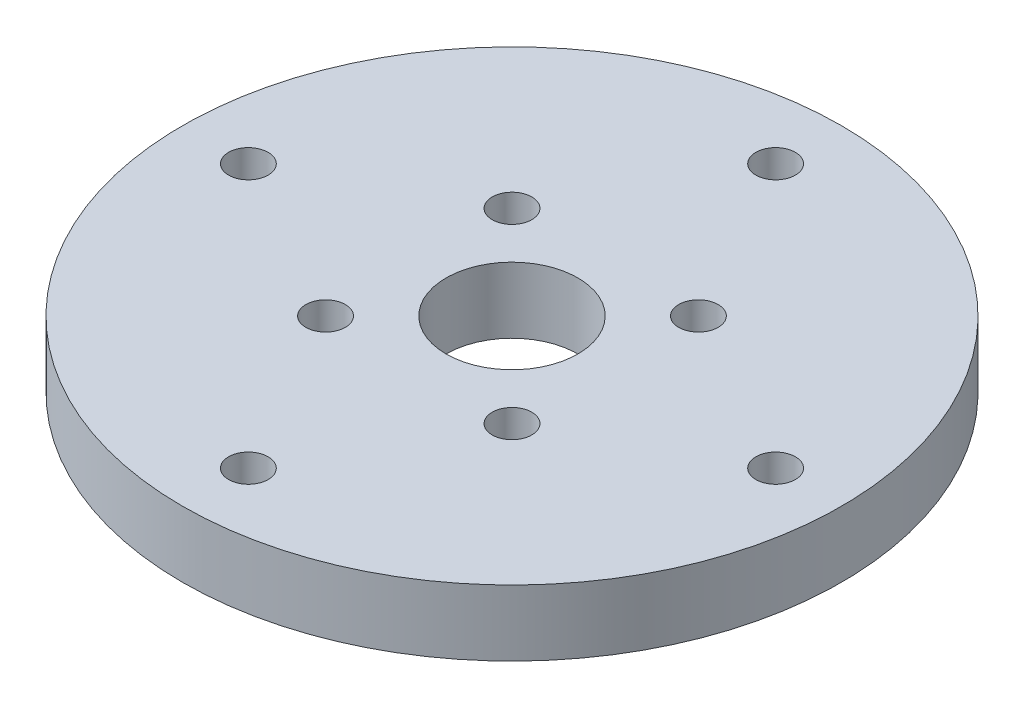
from build123d import *

# Parameters (mm, degrees)
SKETCH_1_R      = 25
SKETCH_1_R_2    = 1.5
SKETCH_1_R_3    = 5
EXTRUDE_1_DEPTH = 5


with BuildPart() as part:
    # 草图1 → 凸台-拉伸1 (new body)
    with BuildSketch(Plane(origin=(0, 0, 0), x_dir=(1, 0, 0), z_dir=(0, 1, 0))):
        with Locations(Location((0, 0, 0), (0, 0, 270))):
            Circle(SKETCH_1_R)
        with Locations(Location((0, 20, 0), (0, 0, 270))):
            Circle(SKETCH_1_R_2, mode=Mode.SUBTRACT)
        with Locations(Location((20, 0, 0), (0, 0, 270))):
            Circle(SKETCH_1_R_2, mode=Mode.SUBTRACT)
        with Locations(Location((0, -20, 0), (0, 0, 270))):
            Circle(SKETCH_1_R_2, mode=Mode.SUBTRACT)
        with Locations(Location((-20, 0, 0), (0, 0, 270))):
            Circle(SKETCH_1_R_2, mode=Mode.SUBTRACT)
        with Locations(Location((-7.071067812, 7.071067812, 0), (0, 0, 270))):
            Circle(SKETCH_1_R_2, mode=Mode.SUBTRACT)
        with Locations(Location((7.071067812, 7.071067812, 0), (0, 0, 270))):
            Circle(SKETCH_1_R_2, mode=Mode.SUBTRACT)
        with Locations(Location((7.071067812, -7.071067812, 0), (0, 0, 270))):
            Circle(SKETCH_1_R_2, mode=Mode.SUBTRACT)
        with Locations(Location((-7.071067812, -7.071067812, 0), (0, 0, 270))):
            Circle(SKETCH_1_R_2, mode=Mode.SUBTRACT)
        with Locations(Location((0, 0, 0), (0, 0, 270))):
            Circle(SKETCH_1_R_3, mode=Mode.SUBTRACT)
    extrude(amount=EXTRUDE_1_DEPTH)


solid = part.part
